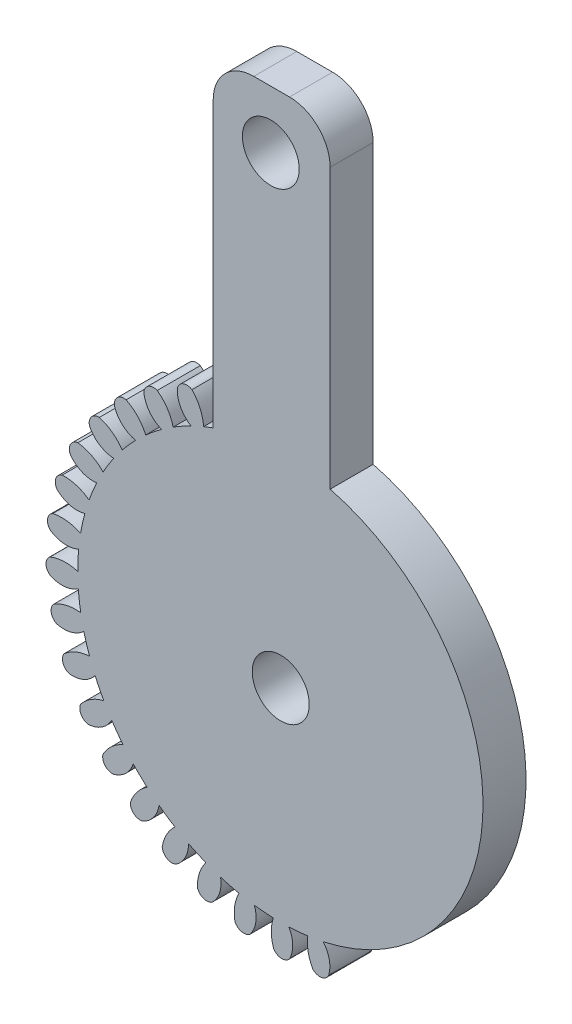
from build123d import *

# Parameters (mm, degrees)
SKETCH1_R           = 12.5
BOSS_EXTRUDE1_DEPTH = 2.65
BOSS_EXTRUDE2_DEPTH = 2.65
CIRPATTERN1_COUNT   = 37
CUT_EXTRUDE1_DEPTH  = 6
SKETCH5_W           = 7.2
SKETCH5_H           = 20
BOSS_EXTRUDE3_DEPTH = 2.65
FILLET1_R           = 2.5
SKETCH6_R           = 1.755
CUT_EXTRUDE2_DEPTH  = 36.020633077
SKETCH7_R           = 1.75
CUT_EXTRUDE3_DEPTH  = 36.020633077


with BuildPart() as part:
    # Sketch1 → Boss-Extrude1 (new body)
    with BuildSketch(Plane.XY):
        Circle(SKETCH1_R)
    extrude(amount=BOSS_EXTRUDE1_DEPTH)

    # Sketch2 → Boss-Extrude2 (add)
    with BuildSketch(Plane.XY.offset(2.65)):
        with BuildLine():
            Line((-1.490008762, 12.410877241), (-0.647496991, 12.483218641))
            ThreePointArc((-0.647496991, 12.483218641), (-0.560389102, 13.376964625), (-0.786565642, 14.245995027))
            ThreePointArc((-0.786565642, 14.245995027), (-1.294727869, 14.469274157), (-1.768283344, 14.179744139))
            ThreePointArc((-1.768283344, 14.179744139), (-1.872233227, 13.257068705), (-1.490008762, 12.410877241))
        make_face()
    boss_extrude2 = extrude(amount=-BOSS_EXTRUDE2_DEPTH)

    # CirPattern1: Boss-Extrude2 ×37 about axis
    cirpattern1_axis = Axis((-0.005621408, 0.062130421, 0), (0, 0, 1))
    for i in range(1, CIRPATTERN1_COUNT):
        add(boss_extrude2.rotate(cirpattern1_axis, i * 360 / CIRPATTERN1_COUNT))

    # Sketch3 → Cut-Extrude1 (cut)
    with BuildSketch(Plane.XY.offset(2.65)):
        with BuildLine():
            ThreePointArc((2.617339204, -12.222910271), (12.455404486, -0.045944124), (2.707439802, 12.203268813))
            ThreePointArc((2.707439802, 12.203268813), (2.478611131, 13.53676799), (3.259731136, 14.641500607))
            ThreePointArc((3.259731136, 14.641500607), (14.955387478, -0.055165786), (3.151627992, -14.665150122))
            ThreePointArc((3.151627992, -14.665150122), (3.390288032, -13.333375366), (2.617339204, -12.222910271))
        make_face()
    extrude(amount=-CUT_EXTRUDE1_DEPTH, mode=Mode.SUBTRACT)

    # Sketch5 → Boss-Extrude3 (add)
    with BuildSketch(Plane.XY.offset(2.65)):
        with Locations((-0.55815824, 21.788117748)):
            Rectangle(SKETCH5_W, SKETCH5_H)
    extrude(amount=-BOSS_EXTRUDE3_DEPTH)

    # Fillet1
    fillet1_edges = [part.edges().sort_by_distance(p)[0] for p in [
        (3.04184176, 31.788117748, 1.325),
        (-4.15815824, 31.788117748, 1.325),
    ]]
    fillet(fillet1_edges, radius=FILLET1_R)

    # Sketch6 → Cut-Extrude2 (cut, through all)
    with BuildSketch(Plane.XY.offset(2.65)):
        Circle(SKETCH6_R)
    extrude(amount=-CUT_EXTRUDE2_DEPTH, mode=Mode.SUBTRACT)

    # Sketch7 → Cut-Extrude3 (cut, through all)
    with BuildSketch(Plane.XY.offset(2.65)):
        with Locations((-0.612089544, 28.238117748)):
            Circle(SKETCH7_R)
    extrude(amount=-CUT_EXTRUDE3_DEPTH, mode=Mode.SUBTRACT)


solid = part.part
